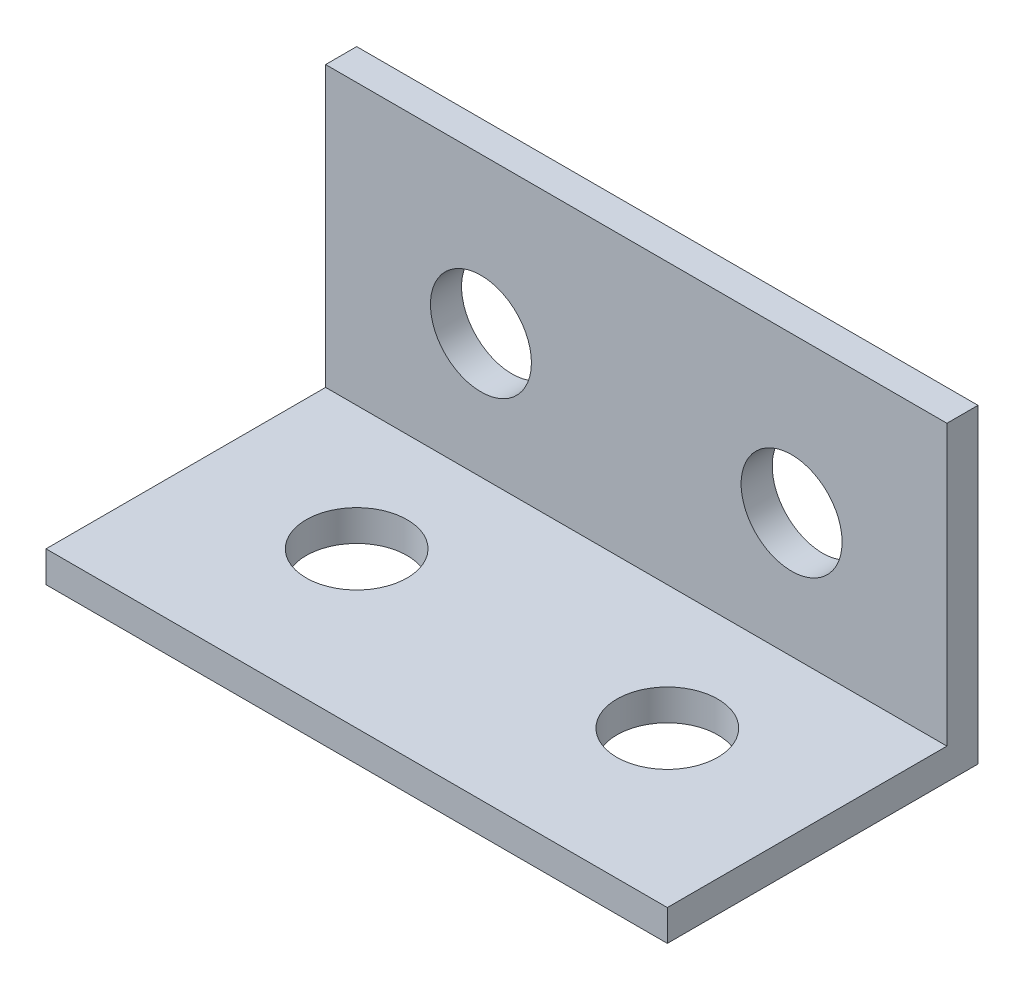
from build123d import *

# Parameters (mm, degrees)
SKETCH1_W           = 40
SKETCH1_H           = 20
SKETCH1_R           = 3.25
BOSS_EXTRUDE1_DEPTH = 2
SKETCH3_W           = 40
SKETCH3_H           = 20
SKETCH3_R           = 3.25
BOSS_EXTRUDE2_DEPTH = 2


with BuildPart() as part:
    # Sketch1 → Boss-Extrude1 (new body)
    with BuildSketch(Plane.XY):
        with Locations((20, 10)):
            Rectangle(SKETCH1_W, SKETCH1_H)
        with Locations((10, 10)):
            Circle(SKETCH1_R, mode=Mode.SUBTRACT)
        with Locations((30, 10)):
            Circle(SKETCH1_R, mode=Mode.SUBTRACT)
    extrude(amount=BOSS_EXTRUDE1_DEPTH)

    # Sketch3 → Boss-Extrude2 (add)
    with BuildSketch(Plane(origin=(0, 0, 0), x_dir=(1, 0, 0), z_dir=(0, 1, 0))):
        with Locations((20, -10)):
            Rectangle(SKETCH3_W, SKETCH3_H)
        with Locations(Location((10, -10, 0), (0, 0, 270))):
            Circle(SKETCH3_R, mode=Mode.SUBTRACT)
        with Locations(Location((30, -10, 0), (0, 0, 270))):
            Circle(SKETCH3_R, mode=Mode.SUBTRACT)
    extrude(amount=BOSS_EXTRUDE2_DEPTH)


solid = part.part
